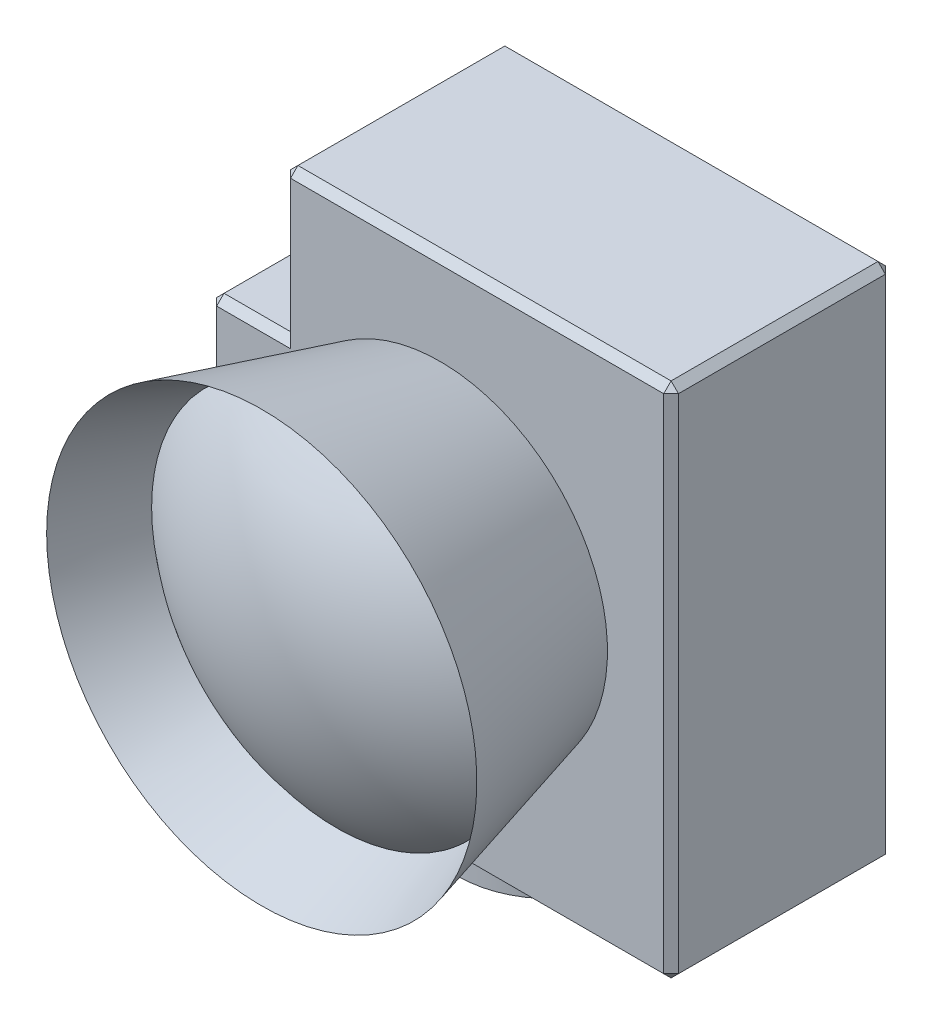
from build123d import *

# Parameters (mm, degrees)
BOSS_EXTRUDE1_DEPTH = 15
SKETCH2_R           = 12.5
BOSS_EXTRUDE2_DEPTH = 4
CHAMFER1_SIZE       = 1


with BuildPart() as part:
    # Sketch1 → Boss-Extrude1 (new, symmetric)
    with BuildSketch(Plane.XY):
        Polygon((31.25, 34.98199207), (-21.25, 34.98199207), (-21.25, 15), (-31.25, 15), (-31.25, -35), (31.25, -35), align=None)
    extrude(amount=BOSS_EXTRUDE1_DEPTH, both=True)

    # Sketch2 → Boss-Extrude2 (add, symmetric)
    with BuildSketch(Plane.XZ.offset(35)):
        with Locations(Location((0, 0, 0), (0, 0, 90))):
            Circle(SKETCH2_R)
    extrude(amount=BOSS_EXTRUDE2_DEPTH, both=True)

    # Chamfer1
    chamfer1_edges = [part.edges().sort_by_distance(p)[0] for p in [
        (-31.25, 15, 0),
        (-21.25, 34.98199207, 0),
        (31.25, 34.98199207, 0),
        (31.25, -35, 0),
        (31.25, -0.009003965, 15),
        (5, 34.98199207, 15),
        (-21.25, 24.990996035, 15),
        (-26.25, 15, 15),
        (-31.25, -10, 15),
        (-26.25, 15, -15),
        (-21.25, 24.990996035, -15),
        (5, 34.98199207, -15),
        (31.25, -0.009003965, -15),
        (0, -35, -15),
        (-31.25, -10, -15),
        (0, -35, 15),
    ]]
    chamfer(chamfer1_edges, length=CHAMFER1_SIZE)

    # Sketch4 → Revolve1 (revolve)
    with BuildSketch(Plane(origin=(0, 0, 0), x_dir=(1, 0, 0), z_dir=(0, 1, 0))):
        Polygon((-22.640271435, -15), (-29.110747562, -39.148145657), (-19.473991816, -15), align=None)
    revolve(axis=Axis((0, 0, 0), (0, 0, 1)))


with BuildPart() as body_2:
    # Sketch5 → Revolve2 (revolve)
    with BuildSketch(Plane(origin=(0, 0, 0), x_dir=(1, 0, 0), z_dir=(0, 1, 0))):
        with BuildLine():
            Line((0, -33.750156277), (0, -38.321403444))
            ThreePointArc((0, -38.321403444), (-13.369092543, -35.913748433), (-25.058279875, -28.993319431))
            add(Edge.make_bspline(
                [(-25.058279875, -28.993319431), (-12.529139937, -33.750156277), (0, -33.750156277)],
                knots=[0, 0, 0, 0.5, 0.5, 0.5], degree=2))
        make_face()
    revolve(axis=Axis((0, 0, 0), (0, 0, 1)))


solid = Compound([part.part, body_2.part])
